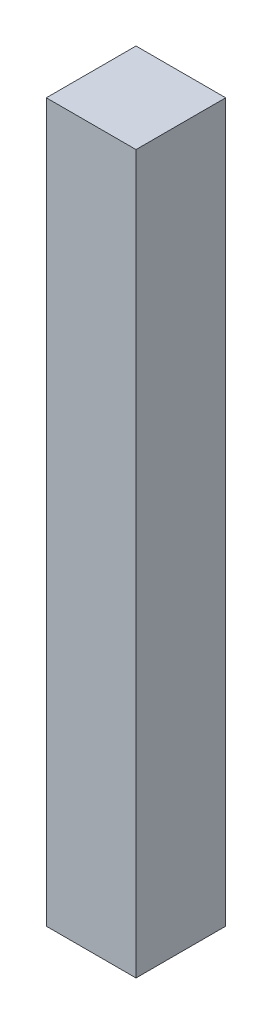
from build123d import *

# Parameters (mm, degrees)
SKETCH1_W           = 50.8
SKETCH1_H           = 50.8
BOSS_EXTRUDE1_DEPTH = 406.4


with BuildPart() as part:
    # Sketch1 → Boss-Extrude1 (new body)
    with BuildSketch(Plane(origin=(0, 0, 0), x_dir=(1, 0, 0), z_dir=(0, 1, 0))):
        Rectangle(SKETCH1_W, SKETCH1_H)
    extrude(amount=BOSS_EXTRUDE1_DEPTH)


solid = part.part
